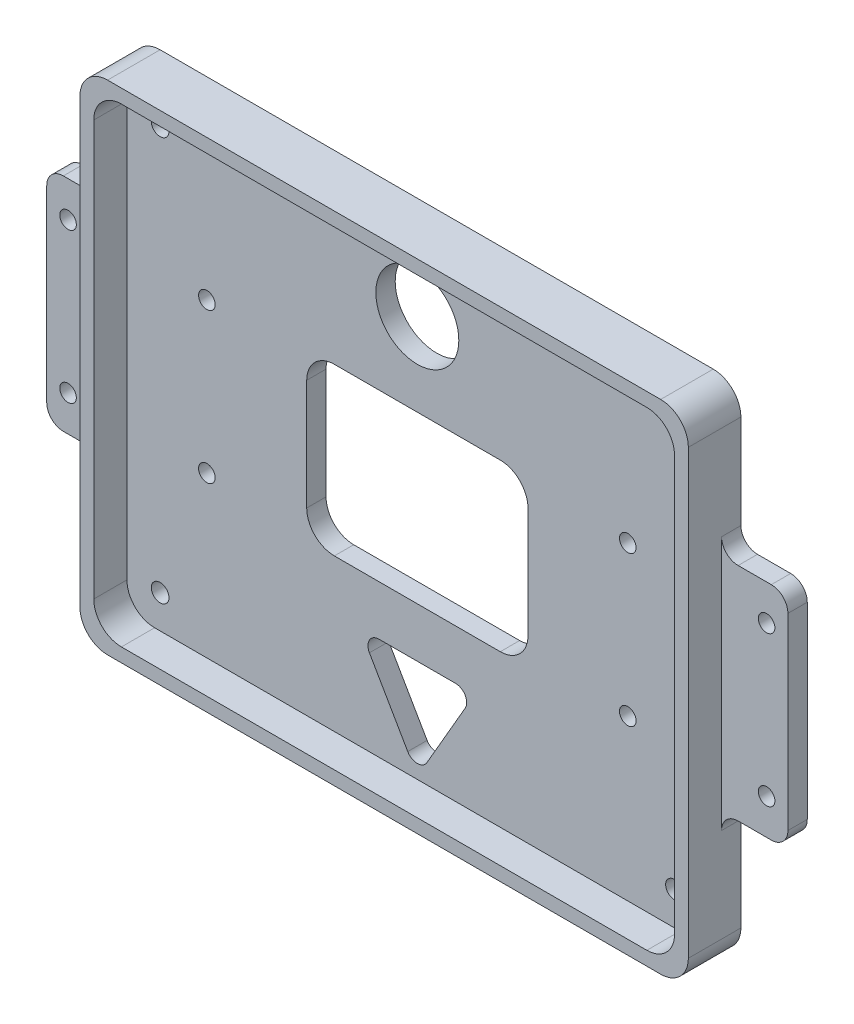
from build123d import *

# Parameters (mm, degrees)
SKETCH1_R           = 1.6
SKETCH1_R_2         = 1.5
BOSS_EXTRUDE1_DEPTH = 3.5
SKETCH2_R           = 7.5
CUT_EXTRUDE1_DEPTH  = 10
BOSS_EXTRUDE2_DEPTH = 6
CUT_EXTRUDE2_DEPTH  = 6
SKETCH5_R           = 1.5
BOSS_EXTRUDE3_DEPTH = 3.5
FILLET1_R           = 3


with BuildPart() as part:
    # Sketch1 → Boss-Extrude1 (new body)
    with BuildSketch(Plane.XY):
        with BuildLine():
            Line((50, -45), (-50, -45))
            ThreePointArc((-50, -45), (-53.535533906, -43.535533906), (-55, -40))
            Line((-55, -40), (-55, 40))
            ThreePointArc((-55, 40), (-53.535533906, 43.535533906), (-50, 45))
            Line((-50, 45), (50, 45))
            ThreePointArc((50, 45), (53.535533906, 43.535533906), (55, 40))
            Line((55, 40), (55, -40))
            ThreePointArc((55, -40), (53.535533906, -43.535533906), (50, -45))
        make_face()
        with Locations((-46.5, 36.5)):
            Circle(SKETCH1_R, mode=Mode.SUBTRACT)
        with Locations((46.5, 36.5)):
            Circle(SKETCH1_R, mode=Mode.SUBTRACT)
        with Locations(Location((46.5, -36.5, 0), (0, 0, 180))):
            Circle(SKETCH1_R, mode=Mode.SUBTRACT)
        with Locations(Location((-46.5, -36.5, 0), (0, 0, 180))):
            Circle(SKETCH1_R, mode=Mode.SUBTRACT)
        with Locations((38.05, 13.55)):
            Circle(SKETCH1_R_2, mode=Mode.SUBTRACT)
        with Locations((38.05, -13.55)):
            Circle(SKETCH1_R_2, mode=Mode.SUBTRACT)
        with Locations(Location((-38.05, -13.55, 0), (0, 0, 180))):
            Circle(SKETCH1_R_2, mode=Mode.SUBTRACT)
        with Locations(Location((-38.05, 13.55, 0), (0, 0, 180))):
            Circle(SKETCH1_R_2, mode=Mode.SUBTRACT)
    extrude(amount=BOSS_EXTRUDE1_DEPTH)

    # Sketch2 → Cut-Extrude1 (cut)
    with BuildSketch(Plane(origin=(0, 0, 0), x_dir=(-1, 0, 0), z_dir=(0, 0, -1))):
        with Locations((0, 30)):
            Circle(SKETCH2_R)
        with BuildLine():
            Line((-15, -15), (15, -15))
            ThreePointArc((15, -15), (18.535533906, -13.535533906), (20, -10))
            Line((20, -10), (20, 10))
            ThreePointArc((20, 10), (18.535533906, 13.535533906), (15, 15))
            Line((15, 15), (-15, 15))
            ThreePointArc((-15, 15), (-18.535533906, 13.535533906), (-20, 10))
            Line((-20, 10), (-20, -10))
            ThreePointArc((-20, -10), (-18.535533906, -13.535533906), (-15, -15))
        make_face()
        with BuildLine():
            Line((1.732050808, -39), (8.660254038, -27))
            ThreePointArc((8.660254038, -27), (8.660254038, -25), (6.92820323, -24))
            Line((6.92820323, -24), (-6.92820323, -24))
            ThreePointArc((-6.92820323, -24), (-8.660254038, -25), (-8.660254038, -27))
            Line((-8.660254038, -27), (-1.732050808, -39))
            ThreePointArc((-1.732050808, -39), (0, -40), (1.732050808, -39))
        make_face()
    extrude(amount=-CUT_EXTRUDE1_DEPTH, mode=Mode.SUBTRACT)

    # Sketch3 → Boss-Extrude2 (add)
    with BuildSketch(Plane.XY.offset(3.5)):
        with BuildLine():
            Line((50, -45), (-50, -45))
            ThreePointArc((-50, -45), (-53.535533906, -43.535533906), (-55, -40))
            Line((-55, -40), (-55, 40))
            ThreePointArc((-55, 40), (-53.535533906, 43.535533906), (-50, 45))
            Line((-50, 45), (50, 45))
            ThreePointArc((50, 45), (53.535533906, 43.535533906), (55, 40))
            Line((55, 40), (55, -40))
            ThreePointArc((55, -40), (53.535533906, -43.535533906), (50, -45))
        make_face()
    extrude(amount=BOSS_EXTRUDE2_DEPTH)

    # Sketch4 → Cut-Extrude2 (cut)
    with BuildSketch(Plane.XY.offset(9.5)):
        with BuildLine():
            Line((47.5, -42.5), (-47.5, -42.5))
            ThreePointArc((-47.5, -42.5), (-51.035533906, -41.035533906), (-52.5, -37.5))
            Line((-52.5, -37.5), (-52.5, 37.5))
            ThreePointArc((-52.5, 37.5), (-51.035533906, 41.035533906), (-47.5, 42.5))
            Line((-47.5, 42.5), (47.5, 42.5))
            ThreePointArc((47.5, 42.5), (51.035533906, 41.035533906), (52.5, 37.5))
            Line((52.5, 37.5), (52.5, -37.5))
            ThreePointArc((52.5, -37.5), (51.035533906, -41.035533906), (47.5, -42.5))
        make_face()
    extrude(amount=-CUT_EXTRUDE2_DEPTH, mode=Mode.SUBTRACT)

    # Sketch5 → Boss-Extrude3 (add)
    # profile 1 of 2: a face of its own
    with BuildSketch(Plane(origin=(0, 0, 0), x_dir=(-1, 0, 0), z_dir=(0, 0, -1))):
        with BuildLine():
            Line((-55, 20), (-64, 20))
            ThreePointArc((-64, 20), (-66.121320344, 19.121320344), (-67, 17))
            Line((-67, 17), (-67, -17))
            ThreePointArc((-67, -17), (-66.121320344, -19.121320344), (-64, -20))
            Line((-64, -20), (-55, -20))
            Line((-55, -20), (-55, 20))
        make_face()
        with Locations((-63.15, 13.55)):
            Circle(SKETCH5_R, mode=Mode.SUBTRACT)
        with Locations((-63.15, -13.55)):
            Circle(SKETCH5_R, mode=Mode.SUBTRACT)
    # profile 2 of 2: a face of its own
    with BuildSketch(Plane(origin=(0, 0, 0), x_dir=(-1, 0, 0), z_dir=(0, 0, -1))):
        with BuildLine():
            Line((64, -20), (55, -20))
            Line((55, -20), (55, 20))
            Line((55, 20), (64, 20))
            ThreePointArc((64, 20), (66.121320344, 19.121320344), (67, 17))
            Line((67, 17), (67, -17))
            ThreePointArc((67, -17), (66.121320344, -19.121320344), (64, -20))
        make_face()
        with Locations(Location((63.15, -13.55, 0), (0, 0, 180))):
            Circle(SKETCH5_R, mode=Mode.SUBTRACT)
        with Locations(Location((63.15, 13.55, 0), (0, 0, 180))):
            Circle(SKETCH5_R, mode=Mode.SUBTRACT)
    extrude(amount=-BOSS_EXTRUDE3_DEPTH)

    # Fillet1
    fillet1_edges = [part.edges().sort_by_distance(p)[0] for p in [
        (55, 20, 1.75),
        (55, -20, 1.75),
        (-55, -20, 1.75),
        (-55, 20, 1.75),
    ]]
    fillet(fillet1_edges, radius=FILLET1_R)


solid = part.part
